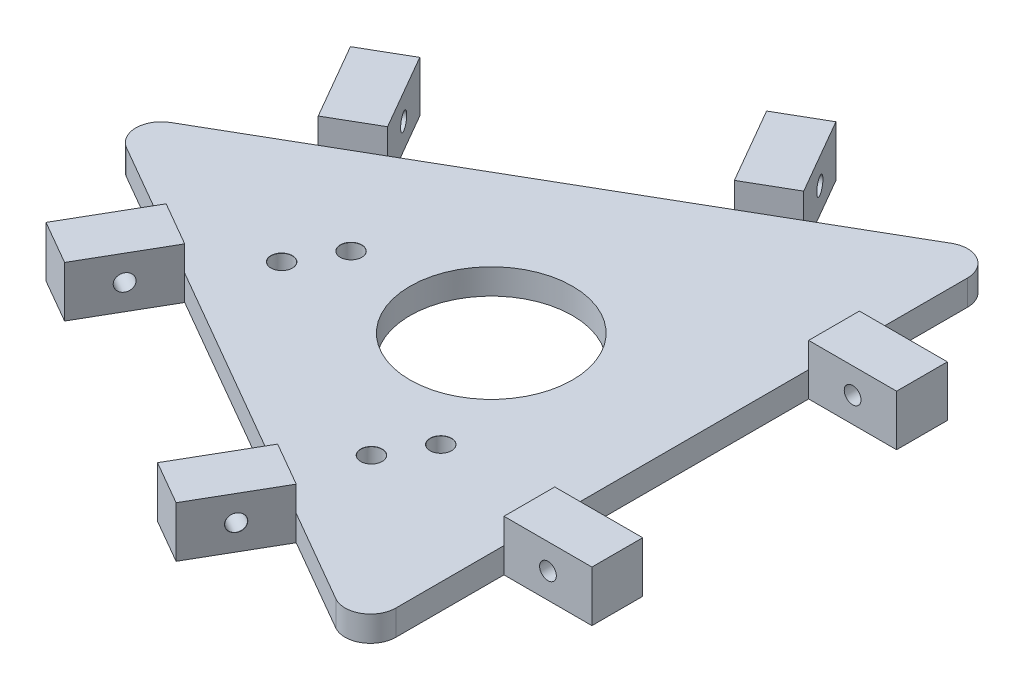
from build123d import *

# Parameters (mm, degrees)
BOSS_EXTRUDE1_DEPTH               = 5
BOSS_EXTRUDE3_DEPTH               = 10
TAP_DRILL_FOR_M4_TAP1_D           = 3.3
TAP_DRILL_FOR_M4_TAP1_CSINK_D     = 3.35
TAP_DRILL_FOR_M4_TAP1_CSINK_ANGLE = 90
CIRPATTERN1_COUNT                 = 3
SKETCH13_R                        = 16
CUT_EXTRUDE1_DEPTH                = 97.030591072
TAP_DRILL_FOR_M5_TAP1_D           = 4.2
TAP_DRILL_FOR_M5_TAP1_CSINK_D     = 4.25
TAP_DRILL_FOR_M5_TAP1_CSINK_ANGLE = 90


with BuildPart() as part:
    # Sketch2 → Boss-Extrude1 (new body)
    with BuildSketch(Plane(origin=(0, 0, 0), x_dir=(0, 0, -1), z_dir=(0, 1, 0))):
        with BuildLine():
            Line((4.330127019, 67.5), (14.975952642, 49.060889132))
            Line((14.975952642, 49.060889132), (19.975952642, 40.400635095))
            Line((19.975952642, 40.400635095), (44.975952642, -2.900635095))
            Line((44.975952642, -2.900635095), (49.975952642, -11.560889132))
            Line((49.975952642, -11.560889132), (60.621778265, -30))
            ThreePointArc((60.621778265, -30), (60.621778265, -35), (56.291651246, -37.5))
            Line((56.291651246, -37.5), (35, -37.5))
            Line((35, -37.5), (25, -37.5))
            Line((25, -37.5), (-25, -37.5))
            Line((-25, -37.5), (-35, -37.5))
            Line((-35, -37.5), (-56.291651246, -37.5))
            ThreePointArc((-56.291651246, -37.5), (-60.621778265, -35), (-60.621778265, -30))
            Line((-60.621778265, -30), (-49.975952642, -11.560889132))
            Line((-49.975952642, -11.560889132), (-44.975952642, -2.900635095))
            Line((-44.975952642, -2.900635095), (-19.975952642, 40.400635095))
            Line((-19.975952642, 40.400635095), (-14.975952642, 49.060889132))
            Line((-14.975952642, 49.060889132), (-4.330127019, 67.5))
            ThreePointArc((-4.330127019, 67.5), (0, 70), (4.330127019, 67.5))
        make_face()
    extrude(amount=BOSS_EXTRUDE1_DEPTH)

    # Sketch2<7> → Boss-Extrude3 (add)
    with BuildSketch(Plane(origin=(0, 0, 0), x_dir=(0, 0, -1), z_dir=(0, 1, 0))):
        Polygon((29.975952642, 57.72114317), (14.975952642, 49.060889132), (19.975952642, 40.400635095), (34.975952642, 49.060889132), align=None)
        Polygon((44.975952642, -2.900635095), (49.975952642, -11.560889132), (64.975952642, -2.900635095), (59.975952642, 5.759618943), align=None)
    boss_extrude3 = extrude(amount=BOSS_EXTRUDE3_DEPTH)

    # Tap Drill for M4 Tap1 (through all)
    with Locations(Plane(origin=(-30.310889132, 0, 17.5), x_dir=(0.49999999999999517, 0, 0.8660254037844415), z_dir=(-0.8660254037844414, 0, 0.4999999999999951))):
        with Locations((-46.160254038, 5)):
            tap_drill_for_m4_tap1 = CounterSinkHole(TAP_DRILL_FOR_M4_TAP1_D / 2, TAP_DRILL_FOR_M4_TAP1_CSINK_D / 2, counter_sink_angle=TAP_DRILL_FOR_M4_TAP1_CSINK_ANGLE)

    # CirPattern1: Boss-Extrude3, Tap Drill for M4 Tap1 ×3 about axis
    cirpattern1_axis = Axis((0, 5, 0), (0, 1, 0))
    add([boss_extrude3.rotate(cirpattern1_axis, i * 360 / CIRPATTERN1_COUNT) for i in range(1, CIRPATTERN1_COUNT)])
    add([tap_drill_for_m4_tap1.rotate(cirpattern1_axis, i * 360 / CIRPATTERN1_COUNT) for i in range(1, CIRPATTERN1_COUNT)], mode=Mode.SUBTRACT)

    # Sketch13 → Cut-Extrude1 (cut, through all)
    with BuildSketch(Plane.XZ):
        with Locations((0.00701443, 0.012149349)):
            Circle(SKETCH13_R)
    extrude(amount=-CUT_EXTRUDE1_DEPTH, mode=Mode.SUBTRACT)

    # Tap Drill for M5 Tap1 (through all)
    with Locations(Plane(origin=(0, 5, 0), x_dir=(1, 0, 0), z_dir=(0, 1, 0))):
        with Locations((-27.789778361, 0.166691947), (-32.789778361, -8.49356209), (14.039248642, -23.983308053), (9.039248642, -32.64356209)):
            CounterSinkHole(TAP_DRILL_FOR_M5_TAP1_D / 2, TAP_DRILL_FOR_M5_TAP1_CSINK_D / 2, counter_sink_angle=TAP_DRILL_FOR_M5_TAP1_CSINK_ANGLE)


solid = part.part
